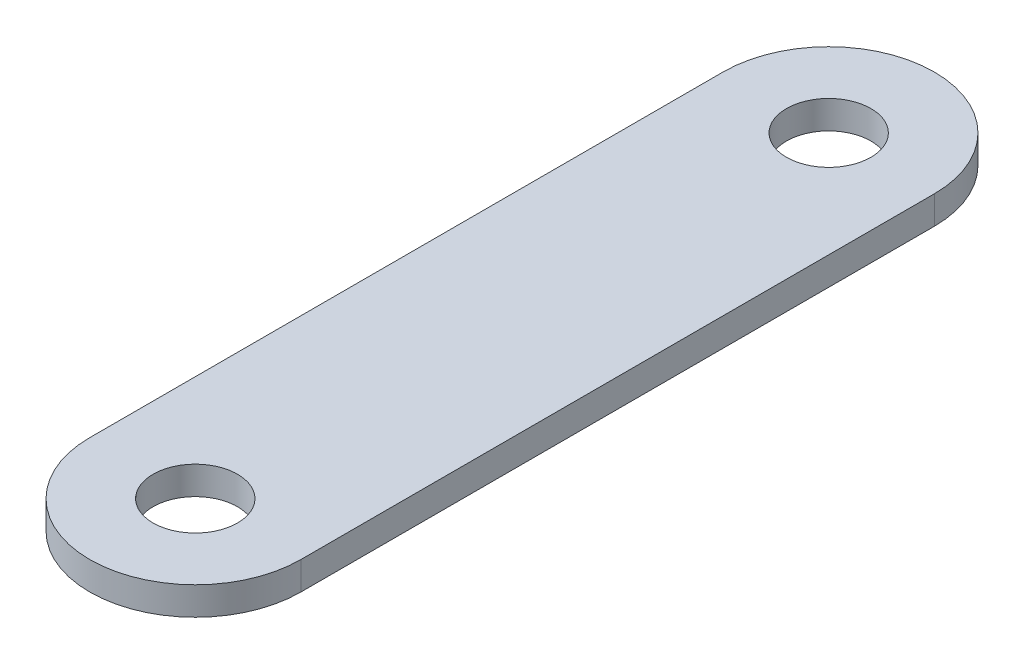
from build123d import *

# Parameters (mm, degrees)
CROQUIS1_R              = 3
SALIENTE_EXTRUIR1_DEPTH = 2


with BuildPart() as part:
    # Croquis1 → Saliente-Extruir1 (new body)
    with BuildSketch(Plane(origin=(0, 0, 0), x_dir=(1, 0, 0), z_dir=(0, 1, 0))):
        with BuildLine():
            Line((-7.5, -22.5), (-7.5, 22.5))
            ThreePointArc((-7.5, 22.5), (0, 30), (7.5, 22.5))
            Line((7.5, 22.5), (7.5, -22.5))
            ThreePointArc((7.5, -22.5), (0, -30), (-7.5, -22.5))
        make_face()
        with Locations(Location((0, 22.5, 0), (0, 0, 270))):
            Circle(CROQUIS1_R, mode=Mode.SUBTRACT)
        with Locations(Location((0, -22.5, 0), (0, 0, 270))):
            Circle(CROQUIS1_R, mode=Mode.SUBTRACT)
    extrude(amount=SALIENTE_EXTRUIR1_DEPTH)


solid = part.part
